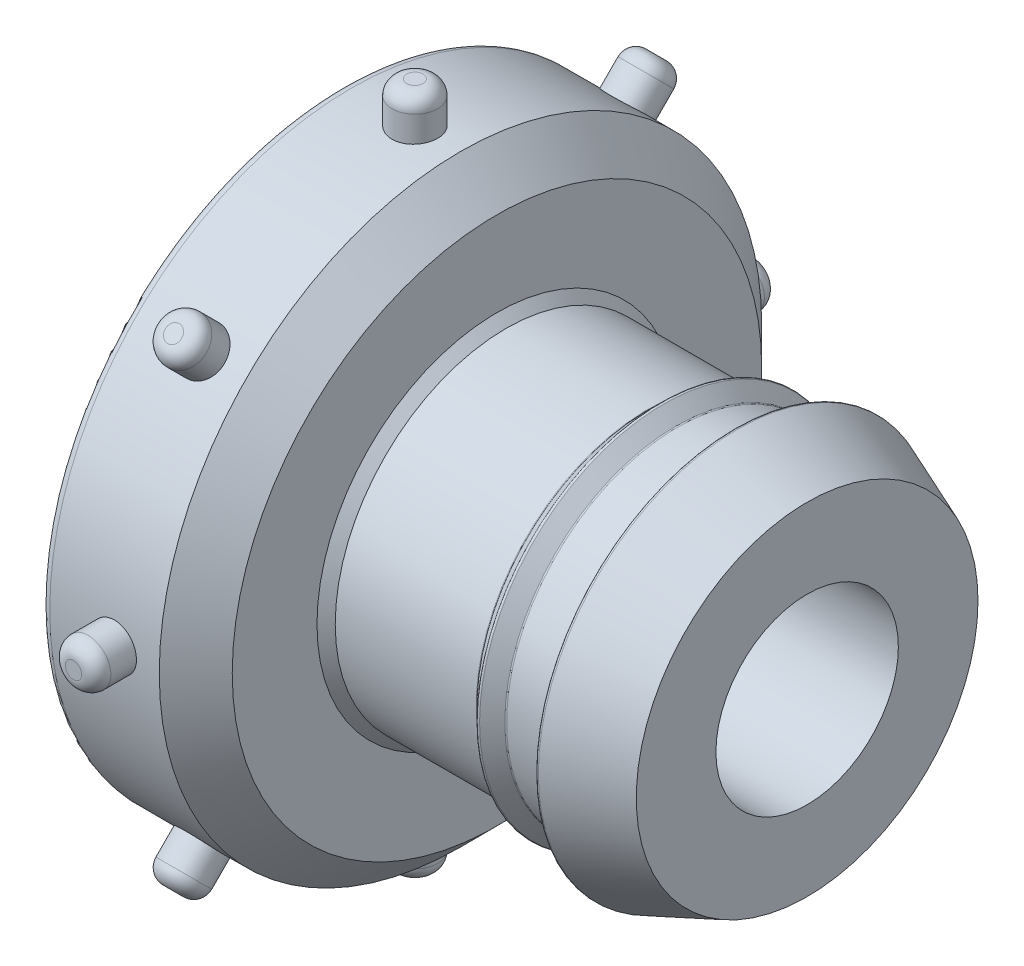
from build123d import *

# Parameters (mm, degrees)
SKETCH2_R                = 16.51
SKETCH2_R_2              = 9.365
SKETCH2_R_3              = 5
BOSS_EXTRUDE1_DEPTH      = 8.5
SKETCH4_W                = 18.18
SKETCH4_H                = 13.55
CUT_EXTRUDE1_DEPTH       = 7
SKETCH6_R                = 0.9
FILLET1_R                = 1
BOSS_EXTRUDE2_START      = -2
SKETCH7_R                = 1.25
BOSS_EXTRUDE2_DEPTH      = 4.2
FILLET2_R                = 0.8
CIRPATTERN1_COUNT        = 8
FILLET2_OF_CIRPATTERN1_R = 0.8
CHAMFER1_SIZE            = 2
FILLET3_R                = 0.5
FILLET4_R                = 0.1
CHAMFER2_SIZE            = 0.5
CUT_EXTRUDE2_DEPTH       = 32.450408582
CUT_EXTRUDE2_DEPTH_BACK  = 32.450408582
SKETCH2_3_R              = 5
CHAMFER3_SIZE            = 1
CHAMFER3_SIZE2           = 4.010780934
SKETCH8_W                = 4.09
SKETCH8_H                = 7.65
BOSS_EXTRUDE3_DEPTH      = 0.64
FILLET5_R                = 0.5


with BuildPart() as part:
    # Sketch1 → Revolve1 (revolve)
    with BuildSketch(Plane(origin=(0, 0, 0), x_dir=(1, 0, 0), z_dir=(0, 1, 0))):
        Polygon((0, 0), (-17, 0), (-17, 9.365), (-8.73, 9.365), (-7.94, 10.155), (-7.15, 9.365), (-3.97, 9.365), (-3.97, 10.955), (0, 9.365), align=None)
    revolve(axis=Axis((0, 0, 0), (-1, 0, 0)))

    # Sketch2 → Boss-Extrude1 (add)
    # profile 1 of 2: a face of its own
    with BuildSketch(Plane.ZY.offset(17)):
        Circle(SKETCH2_R)
        with Locations(Location((0, 0, 0), (0, 0, 180))):
            Circle(SKETCH2_R_2, mode=Mode.SUBTRACT)
    # profile 2 of 2: a face of its own
    with BuildSketch(Plane.ZY.offset(17)):
        with Locations(Location((0, 0, 0), (0, 0, 180))):
            Circle(SKETCH2_R_2)
        Circle(SKETCH2_R_3, mode=Mode.SUBTRACT)
    extrude(amount=BOSS_EXTRUDE1_DEPTH)

    # Sketch4 → Cut-Extrude1 (cut)
    with BuildSketch(Plane.ZY.offset(25.5)):
        with Locations((0, -0.145)):
            Rectangle(SKETCH4_W, SKETCH4_H)
    extrude(amount=-CUT_EXTRUDE1_DEPTH, mode=Mode.SUBTRACT)

    # Sketch6 → Cut-Revolve1 (revolve, cut)
    with BuildSketch(Plane.XY, mode=Mode.PRIVATE) as cut_revolve1_sk:
        with Locations((-25.5, 14.14)):
            Circle(SKETCH6_R)
    revolve(cut_revolve1_sk.sketch.rotate(Axis((-35.027065124, 0, 0), (1, 0, 0)), 90), axis=Axis((-35.027065124, 0, 0), (1, 0, 0)), mode=Mode.SUBTRACT)

    # Fillet1
    fillet1_edges = [part.edges().sort_by_distance(p)[0] for p in [
        (-25.5, 0, -13.24),
    ]]
    fillet(fillet1_edges, radius=FILLET1_R)

    # Sketch7 → Boss-Extrude2 (add)
    with BuildSketch(Plane(origin=(0, 16.51, 0), x_dir=(1, 0, 0), z_dir=(0, 1, 0)).offset(BOSS_EXTRUDE2_START)):
        with Locations(Location((-21.5, 0, 0), (0, 0, 270))):
            Circle(SKETCH7_R)
    boss_extrude2 = extrude(amount=BOSS_EXTRUDE2_DEPTH)

    # Fillet2
    fillet2_edges = [part.edges().sort_by_distance(p)[0] for p in [
        (-21.5, 18.71, -1.25),
    ]]
    fillet(fillet2_edges, radius=FILLET2_R)

    # CirPattern1: Boss-Extrude2 ×8 about axis
    cirpattern1_axis = Axis((0, 0, 0), (1, 0, 0))
    for i in range(1, CIRPATTERN1_COUNT):
        add(boss_extrude2.rotate(cirpattern1_axis, i * 360 / CIRPATTERN1_COUNT))

    # Fillet2 of CirPattern1
    fillet2_of_cirpattern1_edges = [part.edges().sort_by_distance(p)[0] for p in [
        (-21.5, 14.113851352, 12.3460844),
        (-21.5, 1.25, 18.71),
        (-21.5, -12.3460844, 14.113851352),
        (-21.5, -18.71, 1.25),
        (-21.5, -14.113851352, -12.3460844),
        (-21.5, -1.25, -18.71),
        (-21.5, 12.3460844, -14.113851352),
    ]]
    fillet(fillet2_of_cirpattern1_edges, radius=FILLET2_OF_CIRPATTERN1_R)

    # Chamfer1
    chamfer1_edges = [part.edges().sort_by_distance(p)[0] for p in [
        (-17, 0, -16.51),
    ]]
    chamfer(chamfer1_edges, length=CHAMFER1_SIZE)

    # Fillet3
    fillet3_edges = [part.edges().sort_by_distance(p)[0] for p in [
        (-25.5, 0, -16.51),
    ]]
    fillet(fillet3_edges, radius=FILLET3_R)

    # Fillet4
    fillet4_edges = [part.edges().sort_by_distance(p)[0] for p in [
        (-3.97, 0, 9.365),
        (-3.97, 0, 10.955),
        (-8.73, 0, 9.365),
        (-7.94, 0, 10.155),
        (-7.15, 0, 9.365),
    ]]
    fillet(fillet4_edges, radius=FILLET4_R)

    # Chamfer2
    chamfer2_edges = [part.edges().sort_by_distance(p)[0] for p in [
        (-17, 0, 9.365),
    ]]
    chamfer(chamfer2_edges, length=CHAMFER2_SIZE)

    # Sketch2<3> → Cut-Extrude2 (cut, two sides: drawn at the far end of the back side and taken through both)
    with BuildSketch(Plane.ZY.offset(17).offset(-CUT_EXTRUDE2_DEPTH_BACK)):
        with Locations(Location((0, 0, 0), (0, 0, 180))):
            Circle(SKETCH2_3_R)
    extrude(amount=CUT_EXTRUDE2_DEPTH + CUT_EXTRUDE2_DEPTH_BACK, mode=Mode.SUBTRACT)

    # Chamfer3
    chamfer3_edges = [part.edges().sort_by_distance(p)[0] for p in [
        (-25.5, -6.92, 0),
    ]]
    chamfer3_side = [part.faces().sort_by_distance(p)[0] for p in [
        (-25.5, 0, -12.170205593),
    ]]
    chamfer(chamfer3_edges, length=CHAMFER3_SIZE, length2=CHAMFER3_SIZE2, reference=chamfer3_side[0])

    # Sketch8 → Boss-Extrude3 (add)
    with BuildSketch(Plane.ZY.offset(18.5)):
        with Locations((-7.045, -3.095)):
            Rectangle(SKETCH8_W, SKETCH8_H)
    extrude(amount=BOSS_EXTRUDE3_DEPTH)

    # Fillet5
    fillet5_edges = [part.edges().sort_by_distance(p)[0] for p in [
        (-19.14, -3.095, -5),
        (-19.14, 0.73, -7.045),
    ]]
    fillet(fillet5_edges, radius=FILLET5_R)


solid = part.part
